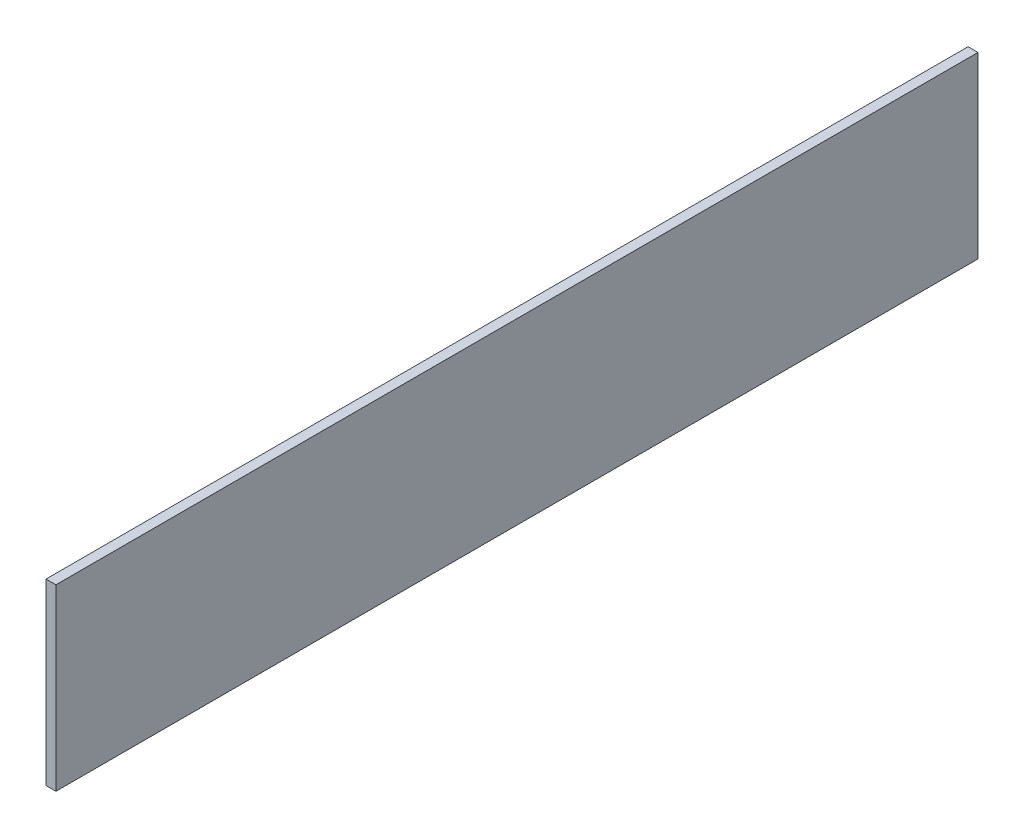
from build123d import *

# Parameters (mm, degrees)
SKETCH1_W           = 3.175
SKETCH1_H           = 57.15
BOSS_EXTRUDE1_DEPTH = 294.64


with BuildPart() as part:
    # Sketch1 → Boss-Extrude1 (new body)
    with BuildSketch(Plane.XY):
        with Locations((1.5875, 28.575)):
            Rectangle(SKETCH1_W, SKETCH1_H)
    extrude(amount=BOSS_EXTRUDE1_DEPTH)


solid = part.part
